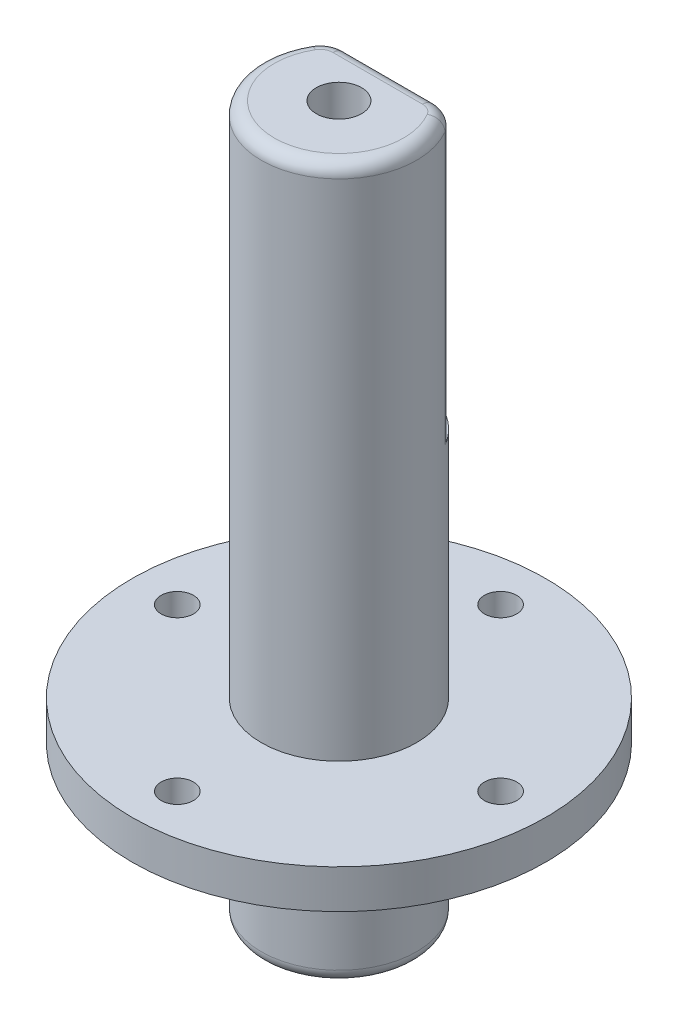
from build123d import *

# Parameters (mm, degrees)
SKETCH1_R           = 6
BOSS_EXTRUDE1_DEPTH = 10
SKETCH2_R           = 10
BOSS_EXTRUDE2_DEPTH = 2
SKETCH5_R           = 16
BOSS_EXTRUDE3_DEPTH = 3
SKETCH6_R           = 6
BOSS_EXTRUDE4_DEPTH = 40
FILLET1_R           = 1
CUT_EXTRUDE1_START  = -22
CUT_EXTRUDE1_DEPTH  = 22
FILLET2_R           = 2
FILLET3_R           = 1
SKETCH10_R          = 1.75
CUT_EXTRUDE2_DEPTH  = 20
SKETCH11_R          = 1.25
CUT_EXTRUDE3_DEPTH  = 7


with BuildPart() as part:
    # Sketch1 → Boss-Extrude1 (new body)
    with BuildSketch(Plane(origin=(0, 0, 0), x_dir=(1, 0, 0), z_dir=(0, 1, 0))):
        with Locations(Location((0, 0, 0), (0, 0, 270))):
            Circle(SKETCH1_R)
    extrude(amount=BOSS_EXTRUDE1_DEPTH)

    # Sketch2 → Boss-Extrude2 (add)
    with BuildSketch(Plane(origin=(0, 10, 0), x_dir=(1, 0, 0), z_dir=(0, 1, 0))):
        with Locations(Location((0, 0, 0), (0, 0, 270))):
            Circle(SKETCH2_R)
    extrude(amount=BOSS_EXTRUDE2_DEPTH)

    # Sketch5 → Boss-Extrude3 (add)
    with BuildSketch(Plane(origin=(0, 12, 0), x_dir=(1, 0, 0), z_dir=(0, 1, 0))):
        with Locations(Location((0, 0, 0), (0, 0, 270))):
            Circle(SKETCH5_R)
    extrude(amount=BOSS_EXTRUDE3_DEPTH)

    # Sketch6 → Boss-Extrude4 (add)
    with BuildSketch(Plane(origin=(0, 15, 0), x_dir=(1, 0, 0), z_dir=(0, 1, 0))):
        with Locations(Location((0, 0, 0), (0, 0, 270))):
            Circle(SKETCH6_R)
    extrude(amount=BOSS_EXTRUDE4_DEPTH)

    # Fillet1
    fillet1_edges = [part.edges().sort_by_distance(p)[0] for p in [
        (0, 0, -6),
    ]]
    fillet(fillet1_edges, radius=FILLET1_R)

    # Sketch7 → Cut-Extrude1 (cut)
    with BuildSketch(Plane(origin=(0, 55, 0), x_dir=(1, 0, 0), z_dir=(0, 1, 0)).offset(CUT_EXTRUDE1_START)):
        with BuildLine():
            Line((-4.472135955, 4), (4.472135955, 4))
            ThreePointArc((4.472135955, 4), (0, 6), (-4.472135955, 4))
        make_face()
    extrude(amount=CUT_EXTRUDE1_DEPTH, mode=Mode.SUBTRACT)

    # Fillet2
    fillet2_edges = [part.edges().sort_by_distance(p)[0] for p in [
        (-4.472135955, 44, -4),
        (4.472135955, 44, -4),
    ]]
    fillet(fillet2_edges, radius=FILLET2_R)

    # Fillet3
    fillet3_edges = [part.edges().sort_by_distance(p)[0] for p in [
        (5.196152423, 55, 3),
        (0, 55, -4),
        (-4.464101615, 55, -3.732050808),
        (4.464101615, 55, -3.732050808),
    ]]
    fillet(fillet3_edges, radius=FILLET3_R)

    # Sketch10 → Cut-Extrude2 (cut)
    with BuildSketch(Plane(origin=(0, 55, 0), x_dir=(1, 0, 0), z_dir=(0, 1, 0))):
        with Locations(Location((0, 0, 0), (0, 0, 270))):
            Circle(SKETCH10_R)
    extrude(amount=-CUT_EXTRUDE2_DEPTH, mode=Mode.SUBTRACT)

    # Sketch11 → Cut-Extrude3 (cut)
    with BuildSketch(Plane(origin=(0, 15, 0), x_dir=(1, 0, 0), z_dir=(0, 1, 0))):
        with Locations(Location((0, 12.5, 0), (0, 0, 270))):
            Circle(SKETCH11_R)
        with Locations(Location((12.5, 0, 0), (0, 0, 270))):
            Circle(SKETCH11_R)
        with Locations(Location((0, -12.5, 0), (0, 0, 270))):
            Circle(SKETCH11_R)
        with Locations(Location((-12.5, 0, 0), (0, 0, 270))):
            Circle(SKETCH11_R)
    extrude(amount=-CUT_EXTRUDE3_DEPTH, mode=Mode.SUBTRACT)


solid = part.part
